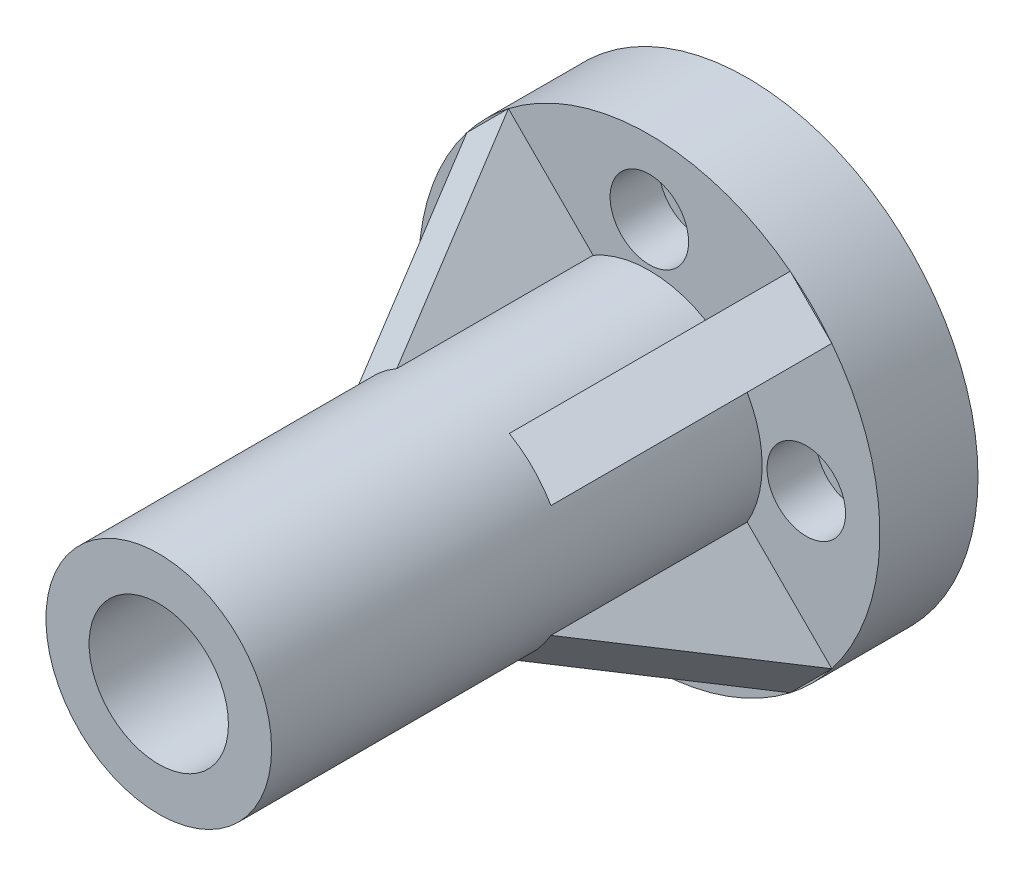
from build123d import *
from build123d.topology import SkipClean

# Parameters (mm, degrees)
CROQUIS1_R                                           = 11.75
SALIENTE_EXTRUIR1_DEPTH                              = 5
REFRENTADO_PARA_TORNILLO_CON_CABEZA_PLAN_D           = 2
REFRENTADO_PARA_TORNILLO_CON_CABEZA_PLAN_CBORE_D     = 4
REFRENTADO_PARA_TORNILLO_CON_CABEZA_PLAN_CBORE_DEPTH = 2.5
CROQUIS6_R                                           = 4.25
CORTAR_EXTRUIR1_DEPTH                                = 1.9
CROQUIS7_R                                           = 5.75
SALIENTE_EXTRUIR2_DEPTH                              = 15
CROQUIS8_R                                           = 5.75
SALIENTE_EXTRUIR3_DEPTH                              = 10
CROQUIS9_R                                           = 3.55
CORTAR_EXTRUIR2_DEPTH                                = 20
SALIENTE_EXTRUIR4_DEPTH                              = 10
CORTAR_EXTRUIR3_DEPTH                                = 3
MATRIZC1_COUNT                                       = 4


with BuildPart() as part:
    # Croquis1 → Saliente-Extruir1 (new body)
    with BuildSketch(Plane.XY):
        Circle(CROQUIS1_R)
    extrude(amount=SALIENTE_EXTRUIR1_DEPTH)

    # Refrentado para tornillo con cabeza plana de M21 (through all)
    with Locations(Plane(origin=(0, 8, 5), x_dir=(1, 0, 0), z_dir=(0, 0, 1))):
        with Locations((0, 0), (7.999986777, -7.985454569), (0, -16), (-8, -8)):
            CounterBoreHole(REFRENTADO_PARA_TORNILLO_CON_CABEZA_PLAN_D / 2, REFRENTADO_PARA_TORNILLO_CON_CABEZA_PLAN_CBORE_D / 2, REFRENTADO_PARA_TORNILLO_CON_CABEZA_PLAN_CBORE_DEPTH)

    # Croquis6 → Cortar-Extruir1 (cut)
    with BuildSketch(Plane(origin=(0, 0, 0), x_dir=(-1, 0, 0), z_dir=(0, 0, -1))):
        with Locations((0, 0.014473443)):
            Circle(CROQUIS6_R)
    extrude(amount=-CORTAR_EXTRUIR1_DEPTH, mode=Mode.SUBTRACT)

    # Croquis7 → Saliente-Extruir2 (add)
    with BuildSketch(Plane.XY.offset(5)):
        Circle(CROQUIS7_R)
    extrude(amount=SALIENTE_EXTRUIR2_DEPTH)

    # Croquis8 → Saliente-Extruir3 (add)
    with BuildSketch(Plane.XY.offset(20)):
        Circle(CROQUIS8_R)
    extrude(amount=SALIENTE_EXTRUIR3_DEPTH)

    # Croquis9 → Cortar-Extruir2 (cut)
    with BuildSketch(Plane.XY.offset(30)):
        Circle(CROQUIS9_R)
    extrude(amount=-CORTAR_EXTRUIR2_DEPTH, mode=Mode.SUBTRACT)

    # Croquis10 → Saliente-Extruir4 (add)
    with SkipClean():  # the faces are left unmerged after this step: merging them gives an invalid solid
        with BuildSketch(Plane.XY.offset(5)):
            with BuildLine():
                Line((-7.342883246, 5.221562902), (-9.301185034, 7.17986469))
                ThreePointArc((-9.301185034, 7.17986469), (-8.308504679, 8.308504679), (-7.17986469, 9.301185034))
                Line((-7.17986469, 9.301185034), (-5.221562902, 7.342883246))
                Line((-5.221562902, 7.342883246), (-2.864419445, 4.985739789))
                ThreePointArc((-2.864419445, 4.985739789), (-4.065863992, 4.065863992), (-4.985739789, 2.864419445))
                Line((-4.985739789, 2.864419445), (-7.342883246, 5.221562902))
            make_face()
        saliente_extruir4 = extrude(amount=SALIENTE_EXTRUIR4_DEPTH)

    # Croquis11 → Cortar-Extruir3 (cut)
    with BuildSketch(Plane(origin=(-1.060660172, -1.060660172, 0), x_dir=(0, 0, 1), z_dir=(-0.7071067811865472, -0.7071067811865478, 0))):
        Polygon((15, 5.550900828), (15, 11.784165538), (5, 11.780723295), (5, 11.653862021), align=None)
    cortar_extruir3 = extrude(amount=-CORTAR_EXTRUIR3_DEPTH, mode=Mode.SUBTRACT)

    # MatrizC1: Saliente-Extruir4, Cortar-Extruir3 ×4 about axis
    with SkipClean():  # the faces are left unmerged after this step: merging them gives an invalid solid
        matrizc1_axis = Axis((0, 0, 0), (0, 0, 1))
        add([saliente_extruir4.rotate(matrizc1_axis, i * 360 / MATRIZC1_COUNT) for i in range(1, MATRIZC1_COUNT)])
        add([cortar_extruir3.rotate(matrizc1_axis, i * 360 / MATRIZC1_COUNT) for i in range(1, MATRIZC1_COUNT)], mode=Mode.SUBTRACT)


solid = part.part
